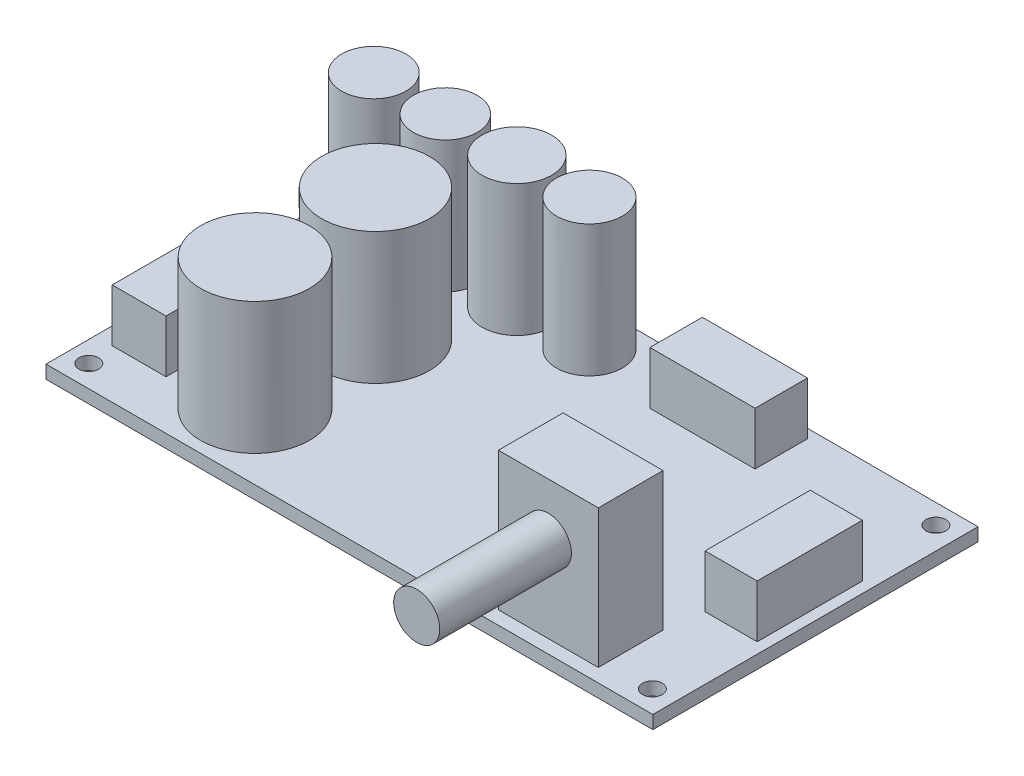
from build123d import *

# Parameters (mm, degrees)
SKETCH1_W           = 92.2
SKETCH1_H           = 49.4
SKETCH1_R           = 1.5
SKETCH1_R_2         = 8.262166988
SKETCH1_R_3         = 8.192856998
SKETCH1_R_4         = 4.886635654
SKETCH1_R_5         = 4.866362118
SKETCH1_R_6         = 5.289603921
SKETCH1_R_7         = 5.006266963
SKETCH1_W_2         = 8.178065913
SKETCH1_H_2         = 16.173235784
SKETCH1_W_3         = 15.980396505
SKETCH1_H_3         = 7.959466721
SKETCH1_W_4         = 7.911671113
SKETCH1_H_4         = 15.979493629
SKETCH1_W_5         = 15.177608392
SKETCH1_H_5         = 9.83005725
BOSS_EXTRUDE1_DEPTH = 2
SKETCH3_W           = 8.178065913
SKETCH3_H           = 16.173235784
SKETCH3_W_2         = 15.980396505
SKETCH3_H_2         = 7.959466721
SKETCH3_W_3         = 7.911671113
SKETCH3_H_3         = 15.979493629
BOSS_EXTRUDE2_DEPTH = 10
SKETCH4_R           = 8.192856998
SKETCH4_R_2         = 8.262166988
SKETCH4_R_3         = 4.886635654
SKETCH4_R_4         = 4.866362118
SKETCH4_R_5         = 5.289603921
SKETCH4_R_6         = 5.006266963
BOSS_EXTRUDE3_DEPTH = 22
SKETCH5_W           = 15.177608392
SKETCH5_H           = 9.83005725
BOSS_EXTRUDE4_DEPTH = 23
SKETCH6_R           = 3.5
BOSS_EXTRUDE5_DEPTH = 20


with BuildPart() as part:
    # Sketch1 → Boss-Extrude1 (new body)
    with BuildSketch(Plane(origin=(0, 0, 0), x_dir=(1, 0, 0), z_dir=(0, 1, 0))):
        with Locations((46.1, 24.7)):
            Rectangle(SKETCH1_W, SKETCH1_H)
        with Locations(Location((3.173958683, 3.331705549, 0), (0, 0, 270))):
            Circle(SKETCH1_R, mode=Mode.SUBTRACT)
        with Locations(Location((88.799397051, 46.406009575, 0), (0, 0, 270))):
            Circle(SKETCH1_R, mode=Mode.SUBTRACT)
        with Locations(Location((88.799397051, 3.331705549, 0), (0, 0, 270))):
            Circle(SKETCH1_R, mode=Mode.SUBTRACT)
        with Locations(Location((21.794183192, 9.960470024, 0), (0, 0, 270))):
            Circle(SKETCH1_R_2, mode=Mode.SUBTRACT)
        with Locations(Location((21.794183192, 28.264813263, 0), (0, 0, 270))):
            Circle(SKETCH1_R_3, mode=Mode.SUBTRACT)
        with Locations(Location((6.541955346, 43.259679485, 0), (0, 0, 270))):
            Circle(SKETCH1_R_4, mode=Mode.SUBTRACT)
        with Locations(Location((17.408846233, 43.259679485, 0), (0, 0, 270))):
            Circle(SKETCH1_R_5, mode=Mode.SUBTRACT)
        with Locations(Location((28.27573712, 43.259679485, 0), (0, 0, 270))):
            Circle(SKETCH1_R_6, mode=Mode.SUBTRACT)
        with Locations(Location((39.303222454, 43.259679485, 0), (0, 0, 270))):
            Circle(SKETCH1_R_7, mode=Mode.SUBTRACT)
        with Locations((6.70046548, 15.533525735)):
            Rectangle(SKETCH1_W_2, SKETCH1_H_2, mode=Mode.SUBTRACT)
        with Locations((59.680344983, 44.042689104)):
            Rectangle(SKETCH1_W_3, SKETCH1_H_3, mode=Mode.SUBTRACT)
        with Locations((86.603660988, 25.480585451)):
            Rectangle(SKETCH1_W_4, SKETCH1_H_4, mode=Mode.SUBTRACT)
        with Locations((74.28567685, 6.953513815)):
            Rectangle(SKETCH1_W_5, SKETCH1_H_5, mode=Mode.SUBTRACT)
    extrude(amount=BOSS_EXTRUDE1_DEPTH)

    # Sketch3 → Boss-Extrude2 (add)
    with BuildSketch(Plane(origin=(0, 0, 0), x_dir=(-1, 0, 0), z_dir=(0, -1, 0))):
        with Locations((-6.70046548, 15.533525735)):
            Rectangle(SKETCH3_W, SKETCH3_H)
        with Locations((-59.680344983, 44.042689104)):
            Rectangle(SKETCH3_W_2, SKETCH3_H_2)
        with Locations((-86.603660988, 25.480585451)):
            Rectangle(SKETCH3_W_3, SKETCH3_H_3)
    extrude(amount=-BOSS_EXTRUDE2_DEPTH)

    # Sketch4 → Boss-Extrude3 (add)
    with BuildSketch(Plane(origin=(0, 0, 0), x_dir=(-1, 0, 0), z_dir=(0, -1, 0))):
        with Locations(Location((-21.794183192, 28.264813263, 0), (0, 0, 90))):
            Circle(SKETCH4_R)
        with Locations(Location((-21.794183192, 9.960470024, 0), (0, 0, 90))):
            Circle(SKETCH4_R_2)
        with Locations(Location((-6.541955346, 43.259679485, 0), (0, 0, 90))):
            Circle(SKETCH4_R_3)
        with Locations(Location((-17.408846233, 43.259679485, 0), (0, 0, 90))):
            Circle(SKETCH4_R_4)
        with Locations(Location((-28.27573712, 43.259679485, 0), (0, 0, 90))):
            Circle(SKETCH4_R_5)
        with Locations(Location((-39.303222454, 43.259679485, 0), (0, 0, 90))):
            Circle(SKETCH4_R_6)
    extrude(amount=-BOSS_EXTRUDE3_DEPTH)

    # Sketch5 → Boss-Extrude4 (add)
    with BuildSketch(Plane(origin=(0, 0, 0), x_dir=(-1, 0, 0), z_dir=(0, -1, 0))):
        with Locations((-74.28567685, 6.953513815)):
            Rectangle(SKETCH5_W, SKETCH5_H)
    extrude(amount=-BOSS_EXTRUDE4_DEPTH)

    # Sketch6 → Boss-Extrude5 (add)
    with BuildSketch(Plane.XY.offset(-2.03848519)):
        with Locations((74.28567685, 15)):
            Circle(SKETCH6_R)
    extrude(amount=BOSS_EXTRUDE5_DEPTH)


solid = part.part
